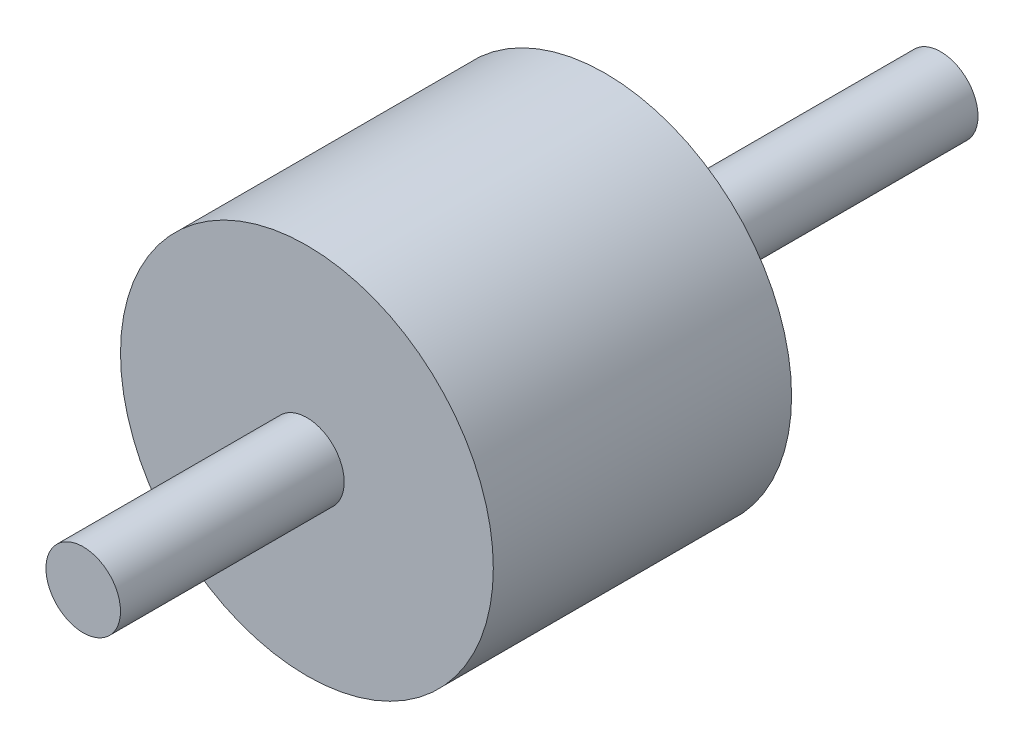
from build123d import *

# Parameters (mm, degrees)
SKETCH1_R           = 25
BOSS_EXTRUDE1_DEPTH = 40
SKETCH1_3_R         = 7.5
BOSS_EXTRUDE2_DEPTH = 10
BOSS_EXTRUDE3_START = 40
SKETCH1_4_R         = 5
BOSS_EXTRUDE3_DEPTH = 30
BOSS_EXTRUDE4_START = -45
SKETCH1_5_R         = 5
BOSS_EXTRUDE4_DEPTH = 115


with BuildPart() as part:
    # Sketch1 → Boss-Extrude1 (new body)
    with BuildSketch(Plane.XY):
        Circle(SKETCH1_R)
    extrude(amount=BOSS_EXTRUDE1_DEPTH)

    # Sketch1<3> → Boss-Extrude2 (add)
    with BuildSketch(Plane.XY):
        Circle(SKETCH1_3_R)
    extrude(amount=-BOSS_EXTRUDE2_DEPTH)

    # Sketch1<4> → Boss-Extrude3 (add)
    with BuildSketch(Plane.XY.offset(BOSS_EXTRUDE3_START)):
        Circle(SKETCH1_4_R)
    extrude(amount=BOSS_EXTRUDE3_DEPTH)

    # Sketch1<5> → Boss-Extrude4 (add)
    with BuildSketch(Plane.XY.offset(BOSS_EXTRUDE4_START)):
        Circle(SKETCH1_5_R)
    extrude(amount=BOSS_EXTRUDE4_DEPTH)


solid = part.part
